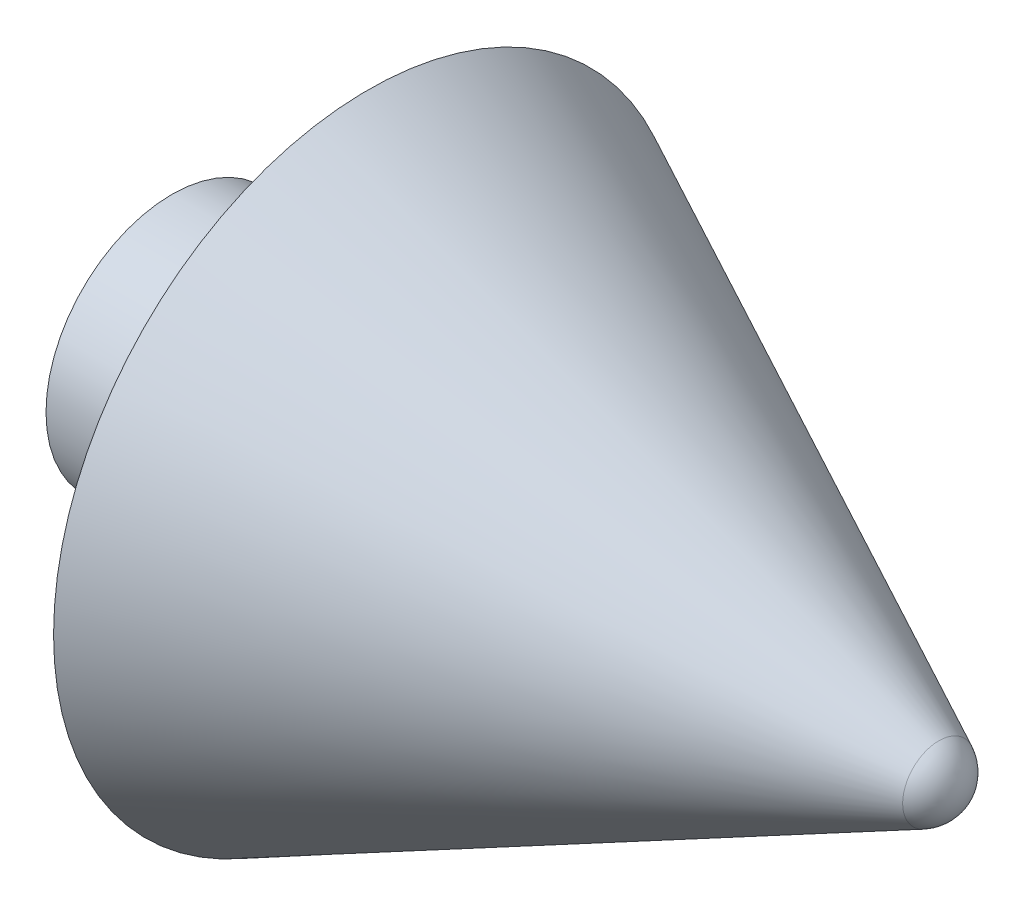
from build123d import *

# Parameters (mm, degrees)
F_8_32_TAPPED_HOLE1_D     = 3.4544
F_8_32_TAPPED_HOLE1_DEPTH = 11.43
F_8_32_TAPPED_HOLE1_TIP   = 1.037806461


with BuildPart() as part:
    # Sketch1 one side → Revolve1 (revolve)
    with BuildSketch(Plane.XY, mode=Mode.PRIVATE) as revolve1_sk:
        with BuildLine():
            Line((0, 3.175), (0, 0))
            Line((0, 0), (19.925615957, 0))
            ThreePointArc((19.925615957, 0), (19.771232823, 0.538397972), (19.355001042, 0.913174751))
            Line((19.355001042, 0.913174751), (4.953, 7.9375))
            Line((4.953, 7.9375), (4.953, 6.2865))
            ThreePointArc((4.953, 6.2865), (5.715, 5.5245), (4.953, 4.7625))
            Line((4.953, 4.7625), (3.175, 4.7625))
            Line((3.175, 4.7625), (3.175, 3.175))
            ThreePointArc((3.175, 3.175), (2.413, 2.413), (1.651, 3.175))
            Line((1.651, 3.175), (0, 3.175))
        make_face()
    revolve(revolve1_sk.sketch.rotate(Axis((-1.467236121, 0, 0), (1, 0, 0)), 90), axis=Axis((-1.467236121, 0, 0), (1, 0, 0)))

    # #8-32 Tapped Hole1
    with Locations(Plane.ZY):
        with Locations((0, 0)):
            Hole(F_8_32_TAPPED_HOLE1_D / 2, depth=F_8_32_TAPPED_HOLE1_DEPTH)
            with Locations((0, 0, -(F_8_32_TAPPED_HOLE1_DEPTH + F_8_32_TAPPED_HOLE1_TIP / 2))):  # 118° drill point
                Cone(0, F_8_32_TAPPED_HOLE1_D / 2, F_8_32_TAPPED_HOLE1_TIP, mode=Mode.SUBTRACT)


solid = part.part
